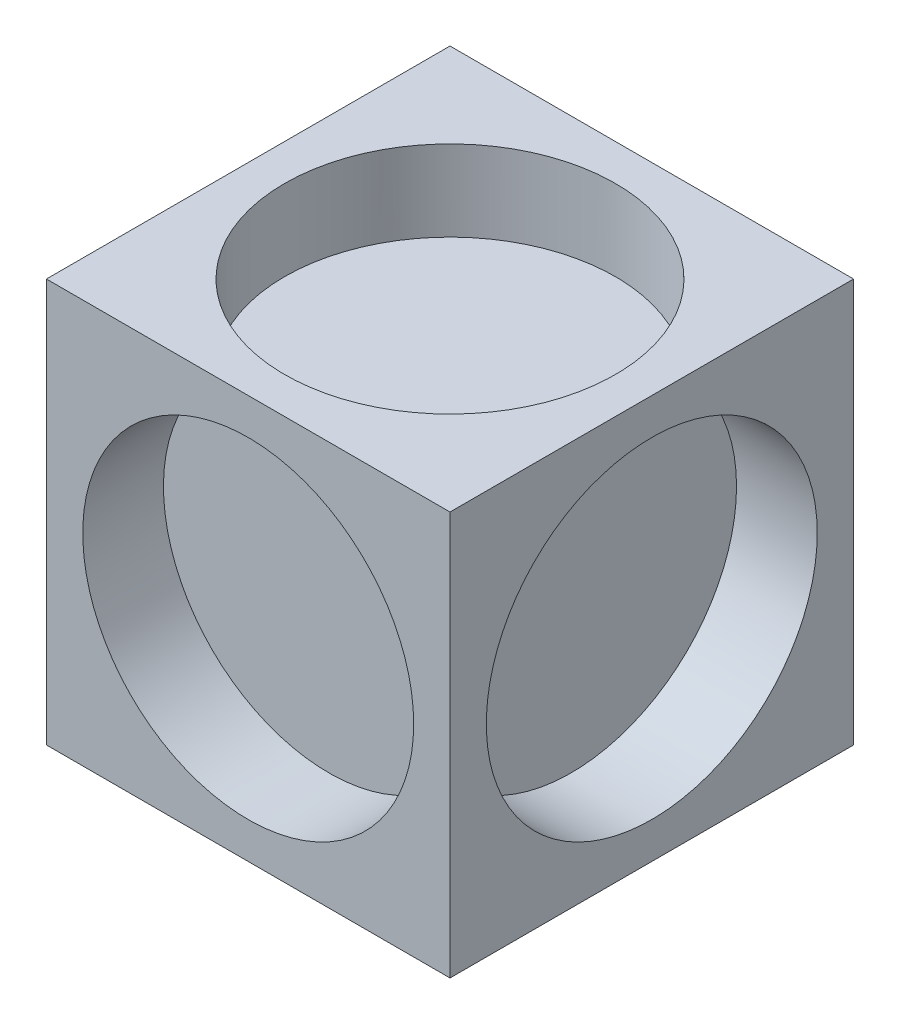
from build123d import *

# Parameters (mm, degrees)
BOSS_EXTRUDE1_DEPTH      = 5
BOSS_EXTRUDE1_DEPTH_BACK = 5
SKETCH1_W                = 10
SKETCH1_H                = 10
SKETCH2_R                = 4.1
CUT_EXTRUDE1_DEPTH       = 2
SKETCH5_R                = 4.1
CUT_EXTRUDE2_DEPTH       = 2
SKETCH6_R                = 4.1
CUT_EXTRUDE3_DEPTH       = 2


with BuildPart() as part:
    # Sketch1 → Boss-Extrude1 (new, two sides: drawn at the far end of the back side and taken through both)
    with BuildSketch(Plane.XY.offset(-BOSS_EXTRUDE1_DEPTH_BACK)):
        Rectangle(SKETCH1_W, SKETCH1_H)
    extrude(amount=BOSS_EXTRUDE1_DEPTH + BOSS_EXTRUDE1_DEPTH_BACK)

    # Sketch2 → Cut-Extrude1 (cut)
    with BuildSketch(Plane(origin=(0, 5, 0), x_dir=(1, 0, 0), z_dir=(0, 1, 0))):
        Circle(SKETCH2_R)
    extrude(amount=-CUT_EXTRUDE1_DEPTH, mode=Mode.SUBTRACT)

    # Sketch5 → Cut-Extrude2 (cut)
    with BuildSketch(Plane.XY.offset(5)):
        Circle(SKETCH5_R)
    extrude(amount=-CUT_EXTRUDE2_DEPTH, mode=Mode.SUBTRACT)

    # Sketch6 → Cut-Extrude3 (cut)
    with BuildSketch(Plane(origin=(5, 0, 0), x_dir=(0, 0, -1), z_dir=(1, 0, 0))):
        Circle(SKETCH6_R)
    extrude(amount=-CUT_EXTRUDE3_DEPTH, mode=Mode.SUBTRACT)


solid = part.part
